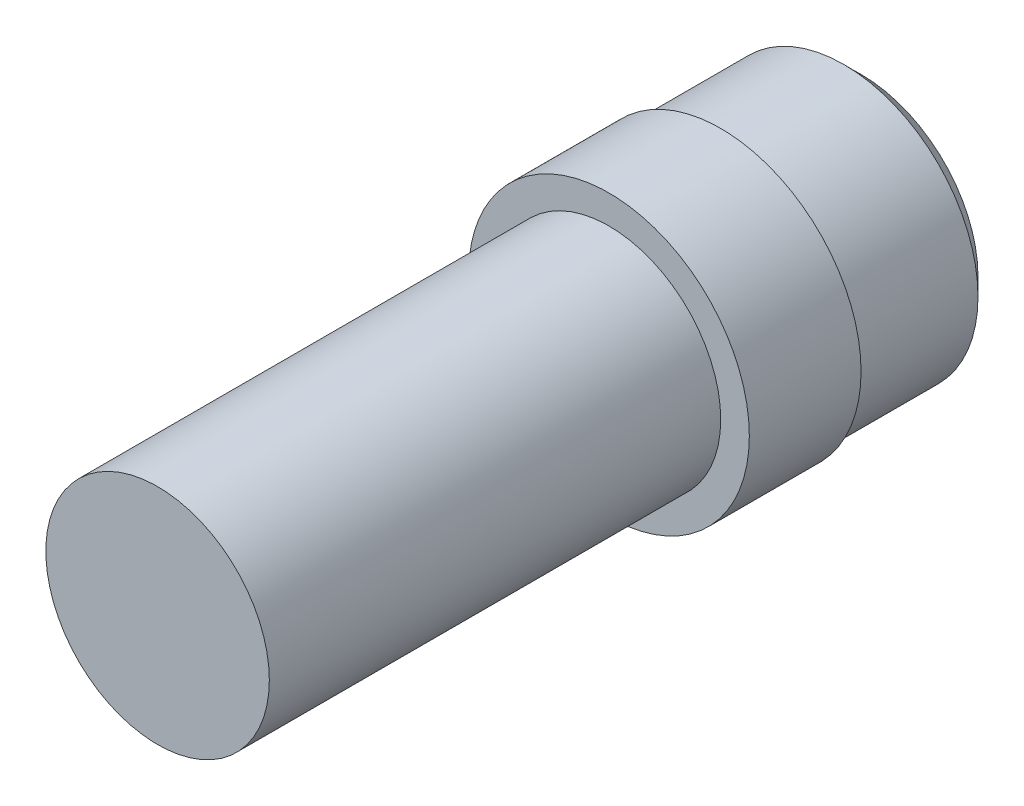
from build123d import *

# Parameters (mm, degrees)
CHAMFER1_SIZE = 0.5


with BuildPart() as part:
    # Sketch1 → Revolve1 (revolve)
    with BuildSketch(Plane(origin=(0, 0, 0), x_dir=(1, 0, 0), z_dir=(0, 1, 0))):
        Polygon((3.175, -20), (0, -20), (0, 0), (3.81, 0), (3.81, -4), (3.9878, -4), (3.9878, -7.175), (3.175, -7.175), align=None)
    revolve(axis=Axis((0, 0, 20), (0, 0, -1)))

    # Chamfer1
    chamfer1_edges = [part.edges().sort_by_distance(p)[0] for p in [
        (-3.81, 0, 0),
    ]]
    chamfer(chamfer1_edges, length=CHAMFER1_SIZE)


solid = part.part
